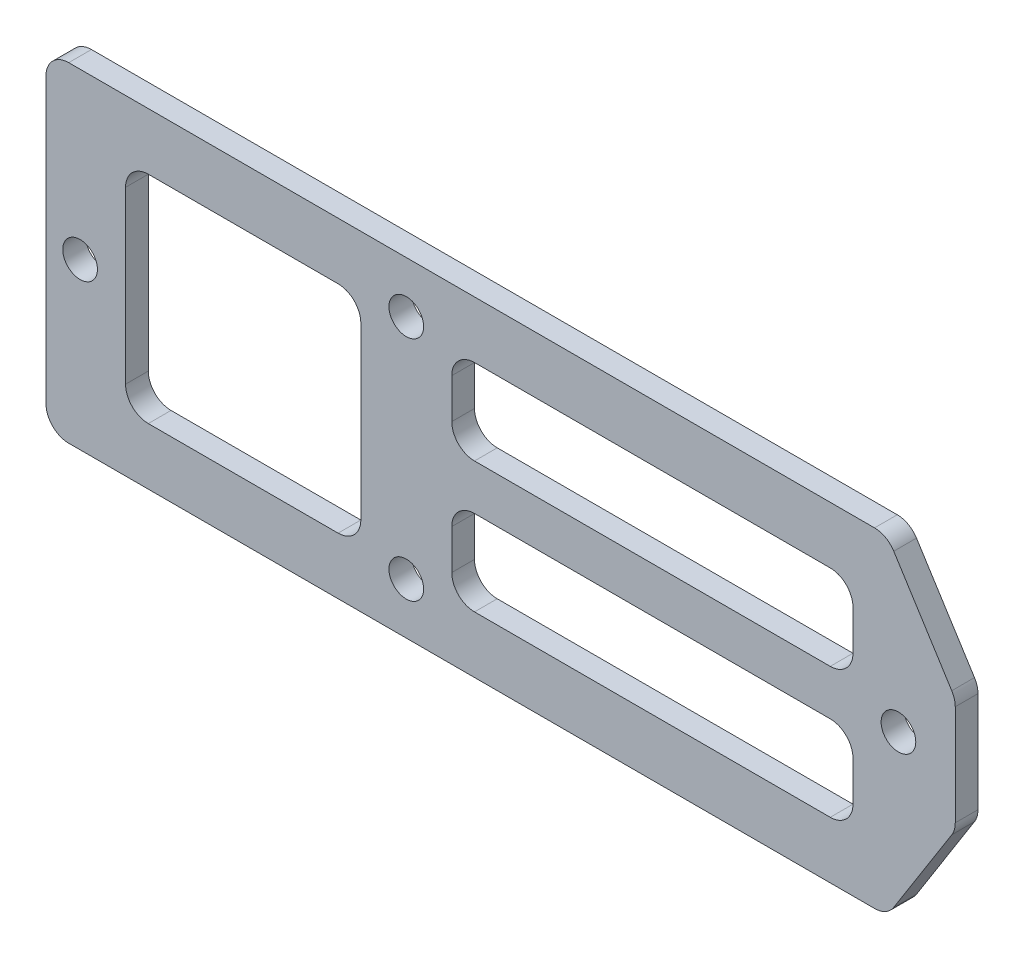
from build123d import *

# Parameters (mm, degrees)
SKETCH_1_W          = 80
SKETCH_1_H          = 29
EXTRUDE_1_DEPTH     = 2
CUT_EXTRUDE_1_DEPTH = 2
SKETCH_3_R          = 1.525
CUT_EXTRUDE_2_DEPTH = 10
SKETCH_4_R          = 1.525
CUT_EXTRUDE_3_DEPTH = 10
FILLET_1_R          = 2
SKETCH_5_W          = 20.7
SKETCH_5_H          = 19
CUT_EXTRUDE_4_DEPTH = 10
SKETCH_6_W          = 35.3
SKETCH_6_H          = 7.5
CUT_EXTRUDE_5_DEPTH = 10
FILLET_2_R          = 2


with BuildPart() as part:
    # 草图1 → 凸台-拉伸1 (new body)
    with BuildSketch(Plane.XY):
        Rectangle(SKETCH_1_W, SKETCH_1_H)
    extrude(amount=EXTRUDE_1_DEPTH)

    # 草图2 → 切除-拉伸1 (cut)
    with BuildSketch(Plane.XY.offset(2)):
        Polygon((34, 14.5), (40, 5), (40, 14.5), align=None)
        Polygon((40, -14.5), (34, -14.5), (40, -5), align=None)
    extrude(amount=-CUT_EXTRUDE_1_DEPTH, mode=Mode.SUBTRACT)

    # 草图3 → 切除-拉伸2 (cut)
    with BuildSketch(Plane.XY.offset(2)):
        with Locations((-8.3, 10)):
            Circle(SKETCH_3_R)
        with Locations((-37, 0)):
            Circle(SKETCH_3_R)
        with Locations((-8.3, -10)):
            Circle(SKETCH_3_R)
    extrude(amount=-CUT_EXTRUDE_2_DEPTH, mode=Mode.SUBTRACT)

    # 草图4 → 切除-拉伸3 (cut)
    with BuildSketch(Plane.XY.offset(2)):
        with Locations((35, 0)):
            Circle(SKETCH_4_R)
    extrude(amount=-CUT_EXTRUDE_3_DEPTH, mode=Mode.SUBTRACT)

    # 圆角1
    fillet_1_edges = [part.edges().sort_by_distance(p)[0] for p in [
        (34, 14.5, 1),
        (40, 5, 1),
        (40, -5, 1),
        (34, -14.5, 1),
        (-40, -14.5, 1),
        (-40, 14.5, 1),
    ]]
    fillet(fillet_1_edges, radius=FILLET_1_R)

    # 草图5 → 切除-拉伸4 (cut)
    with BuildSketch(Plane.XY.offset(2)):
        with Locations((-22.65, 0)):
            Rectangle(SKETCH_5_W, SKETCH_5_H)
    extrude(amount=-CUT_EXTRUDE_4_DEPTH, mode=Mode.SUBTRACT)

    # 草图6 → 切除-拉伸5 (cut)
    with BuildSketch(Plane.XY.offset(2)):
        with Locations((13.35, 5.75)):
            Rectangle(SKETCH_6_W, SKETCH_6_H)
        with Locations((13.35, -5.75)):
            Rectangle(SKETCH_6_W, SKETCH_6_H)
    extrude(amount=-CUT_EXTRUDE_5_DEPTH, mode=Mode.SUBTRACT)

    # 圆角2
    fillet_2_edges = [part.edges().sort_by_distance(p)[0] for p in [
        (-33, 9.5, 1),
        (-12.3, 9.5, 1),
        (-12.3, -9.5, 1),
        (-33, -9.5, 1),
        (-4.3, 2, 1),
        (-4.3, 9.5, 1),
        (31, 9.5, 1),
        (31, 2, 1),
        (-4.3, -2, 1),
        (31, -2, 1),
        (31, -9.5, 1),
        (-4.3, -9.5, 1),
    ]]
    fillet(fillet_2_edges, radius=FILLET_2_R)


solid = part.part
